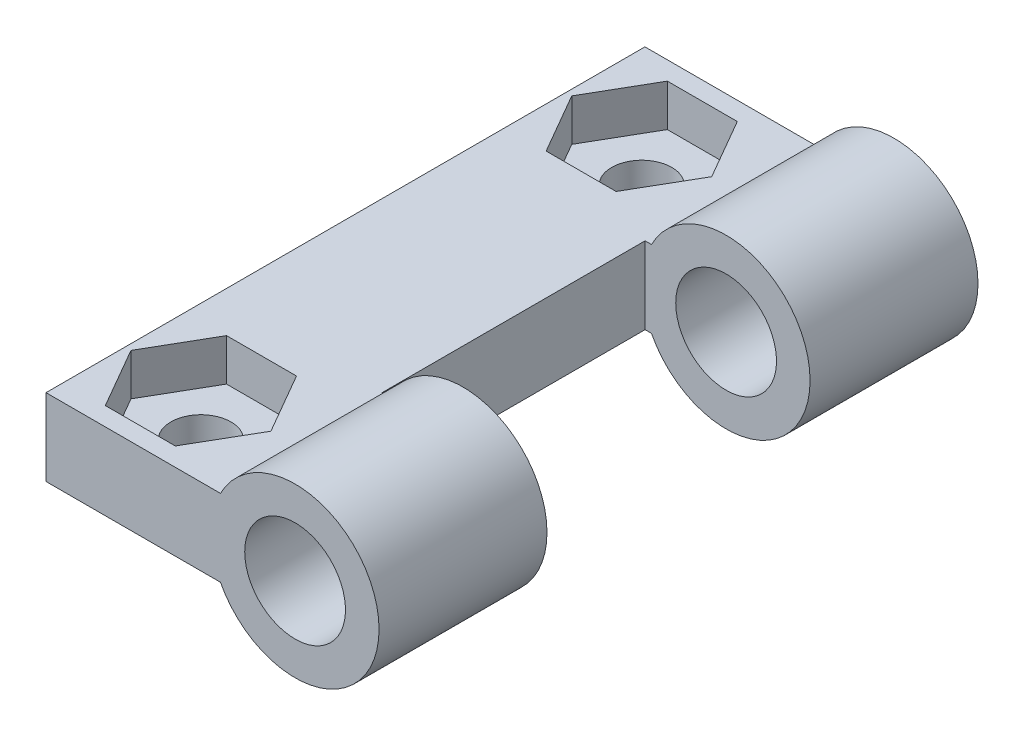
from build123d import *

# Parameters (mm, degrees)
SKETCH_1_W          = 17.8
SKETCH_1_H          = 42.8
EXTRUDE_1_DEPTH     = 5.5
SKETCH_2_R          = 6
EXTRUDE_2_DEPTH     = 12
EXTRUDE_START       = -12
SKETCH_3_R          = 6
EXTRUDE_3_DEPTH     = 12
SKETCH_4_R          = 3.60024343
CUT_EXTRUDE_1_DEPTH = 51
SKETCH_5_W          = 5.942865046
SKETCH_5_H          = 10.697157082
CUT_EXTRUDE_2_DEPTH = 18.8
SKETCH_6_R          = 2.15
CUT_EXTRUDE_3_DEPTH = 10
CUT_EXTRUDE_4_DEPTH = 3


with BuildPart() as part:
    # 草图1 → 凸台-拉伸1 (new body)
    with BuildSketch(Plane(origin=(0, 0, 0), x_dir=(1, 0, 0), z_dir=(0, 1, 0))):
        with Locations((8.9, -21.4)):
            Rectangle(SKETCH_1_W, SKETCH_1_H)
    extrude(amount=EXTRUDE_1_DEPTH)

    # 草图2 → 凸台-拉伸2 (add)
    with BuildSketch(Plane(origin=(0, 0, 0), x_dir=(-1, 0, 0), z_dir=(0, 0, -1))):
        with Locations((-17.8, 2.75)):
            Circle(SKETCH_2_R)
    extrude(amount=-EXTRUDE_2_DEPTH)

    # 草图3 → 凸台-拉伸3 (add)
    with BuildSketch(Plane.XY.offset(42.8).offset(EXTRUDE_START)):
        with Locations((17.8, 2.75)):
            Circle(SKETCH_3_R)
    extrude(amount=EXTRUDE_3_DEPTH)

    # 草图4 → 切除-拉伸1 (cut)
    with BuildSketch(Plane(origin=(0, 0, 0), x_dir=(-1, 0, 0), z_dir=(0, 0, -1))):
        with Locations((-17.8, 2.75)):
            Circle(SKETCH_4_R)
    extrude(amount=-CUT_EXTRUDE_1_DEPTH, mode=Mode.SUBTRACT)

    # 草图5 → 切除-拉伸2 (cut)
    with BuildSketch(Plane(origin=(0, 0, 30.8), x_dir=(-1, 0, 0), z_dir=(0, 0, -1))):
        with Locations((-14.980093676, 2.655560542)):
            Rectangle(SKETCH_5_W, SKETCH_5_H)
    extrude(amount=CUT_EXTRUDE_2_DEPTH, mode=Mode.SUBTRACT)

    # 草图6 → 切除-拉伸3 (cut)
    with BuildSketch(Plane(origin=(0, 5.5, 0), x_dir=(1, 0, 0), z_dir=(0, 1, 0))):
        with Locations(Location((5.420411498, -5.65, 0), (0, 0, 270))):
            Circle(SKETCH_6_R)
        with Locations(Location((5.420411498, -37.15, 0), (0, 0, 270))):
            Circle(SKETCH_6_R)
    extrude(amount=-CUT_EXTRUDE_3_DEPTH, mode=Mode.SUBTRACT)

    # 草图7 → 切除-拉伸4 (cut)
    with BuildSketch(Plane(origin=(0, 5.5, 0), x_dir=(1, 0, 0), z_dir=(0, 1, 0))):
        Polygon((2.920411498, -1.319872981), (7.920411498, -1.319872981), (10.420411498, -5.65), (7.920411498, -9.980127019), (2.920411498, -9.980127019), (0.420411498, -5.65), align=None)
        Polygon((0.420411498, -37.15), (2.920411498, -32.819872981), (7.920411498, -32.819872981), (10.420411498, -37.15), (7.920411498, -41.480127019), (2.920411498, -41.480127019), align=None)
    extrude(amount=-CUT_EXTRUDE_4_DEPTH, mode=Mode.SUBTRACT)


solid = part.part
